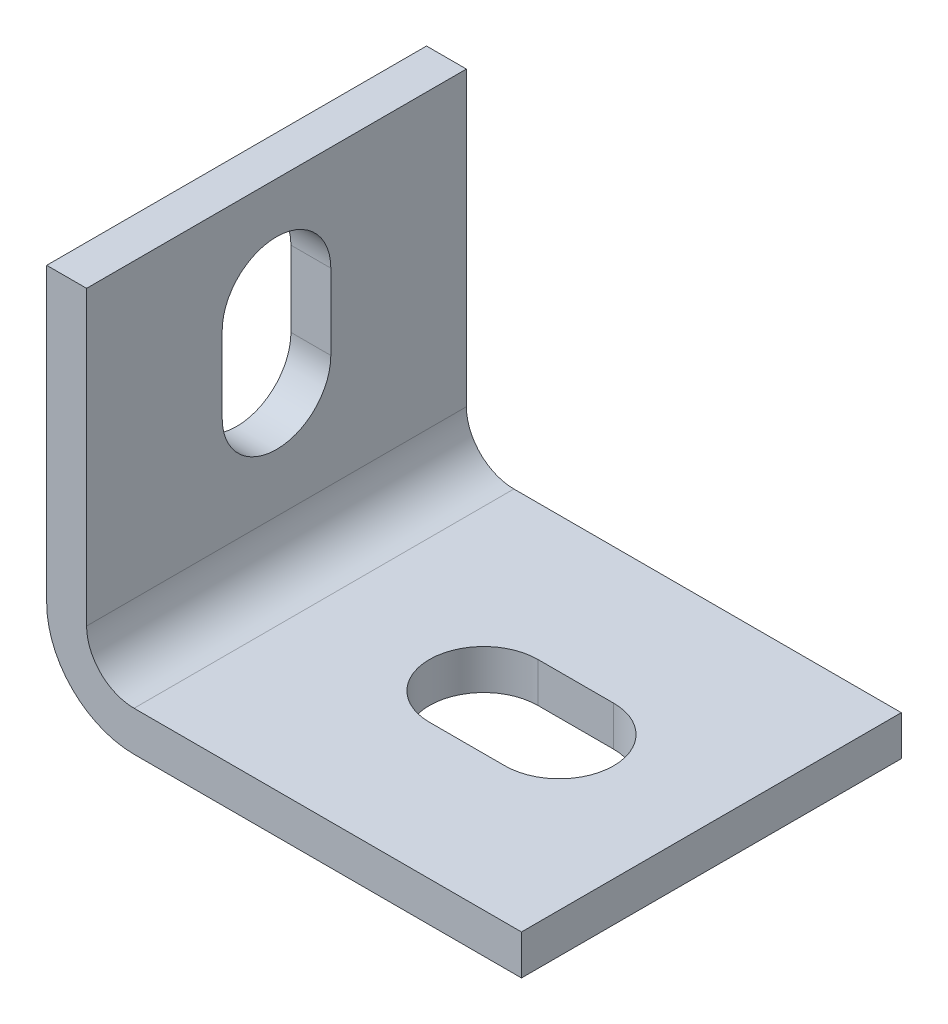
from build123d import *

# Parameters (mm, degrees)
BOSS_EXTRUDE1_DEPTH = 25.4
CUT_EXTRUDE1_DEPTH  = 47.218404224
CUT_EXTRUDE2_DEPTH  = 47.583385332


with BuildPart() as part:
    # Sketch2 → Boss-Extrude1 (new body)
    with BuildSketch(Plane.XY):
        with BuildLine():
            Line((0, 5.842), (0, 25.4))
            Line((0, 25.4), (2.667, 25.4))
            Line((2.667, 25.4), (2.667, 5.842))
            ThreePointArc((2.667, 5.842), (3.59693597, 3.59693597), (5.842, 2.667))
            Line((5.842, 2.667), (31.75, 2.667))
            Line((31.75, 2.667), (31.75, 0))
            Line((31.75, 0), (5.842, 0))
            ThreePointArc((5.842, 0), (1.711082184, 1.711082184), (0, 5.842))
        make_face()
    extrude(amount=BOSS_EXTRUDE1_DEPTH)

    # Sketch3 → Cut-Extrude1 (cut, through all)
    with BuildSketch(Plane(origin=(2.667, 0, 0), x_dir=(0, 0, -1), z_dir=(1, 0, 0))):
        with BuildLine():
            Line((-9.0678, 18.4023), (-9.0678, 13.3477))
            ThreePointArc((-9.0678, 13.3477), (-12.7, 9.7155), (-16.3322, 13.3477))
            Line((-16.3322, 13.3477), (-16.3322, 18.4023))
            ThreePointArc((-16.3322, 18.4023), (-12.7, 22.0345), (-9.0678, 18.4023))
        make_face()
    extrude(amount=-CUT_EXTRUDE1_DEPTH, mode=Mode.SUBTRACT)

    # Sketch4 → Cut-Extrude2 (cut, through all)
    with BuildSketch(Plane(origin=(0, 2.667, 0), x_dir=(1, 0, 0), z_dir=(0, 1, 0))):
        with BuildLine():
            Line((21.5773, -16.3322), (16.5227, -16.3322))
            ThreePointArc((16.5227, -16.3322), (12.8905, -12.7), (16.5227, -9.0678))
            Line((16.5227, -9.0678), (21.5773, -9.0678))
            ThreePointArc((21.5773, -9.0678), (25.2095, -12.7), (21.5773, -16.3322))
        make_face()
    extrude(amount=-CUT_EXTRUDE2_DEPTH, mode=Mode.SUBTRACT)


solid = part.part
